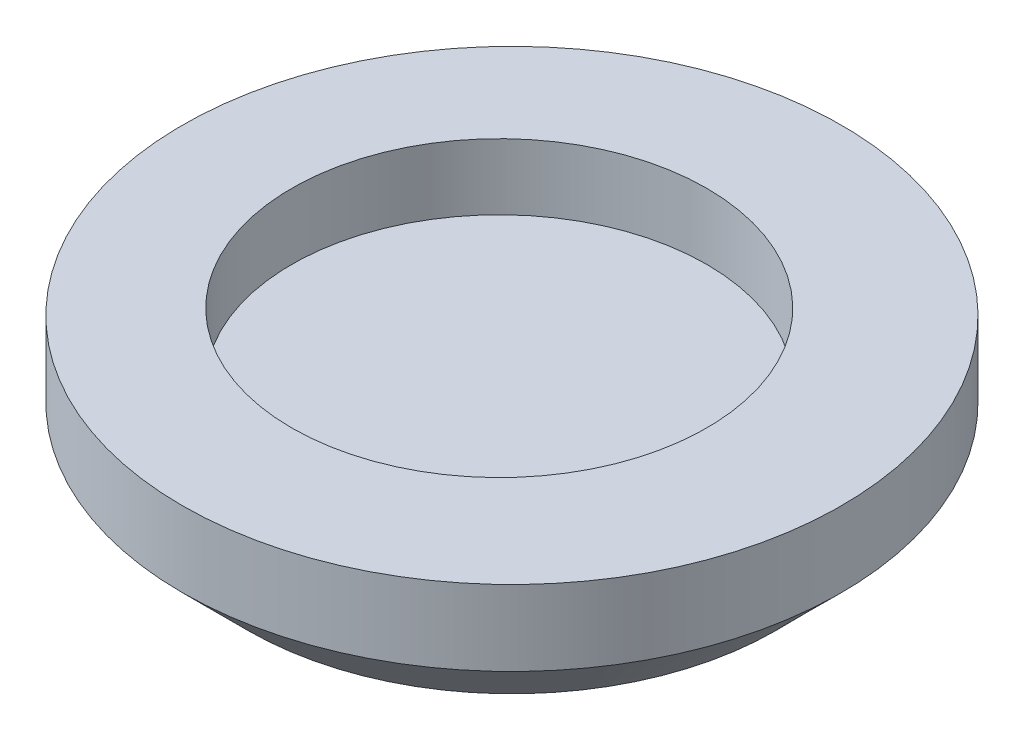
from build123d import *

# Parameters (mm, degrees)
SKETCH1_R           = 35
BOSS_EXTRUDE1_DEPTH = 15
CHAMFER2_SIZE       = 7
SKETCH2_R           = 22.041880944
CUT_EXTRUDE1_DEPTH  = 7


with BuildPart() as part:
    # Sketch1 → Boss-Extrude1 (new body)
    with BuildSketch(Plane(origin=(0, 0, 0), x_dir=(1, 0, 0), z_dir=(0, 1, 0))):
        with Locations(Location((1.345738872, 0, 0), (0, 0, 270))):
            Circle(SKETCH1_R)
    extrude(amount=BOSS_EXTRUDE1_DEPTH)

    # Chamfer2
    chamfer2_edges = [part.edges().sort_by_distance(p)[0] for p in [
        (1.345738872, 0, -35),
    ]]
    chamfer(chamfer2_edges, length=CHAMFER2_SIZE)

    # Sketch2 → Cut-Extrude1 (cut)
    with BuildSketch(Plane(origin=(0, 15, 0), x_dir=(1, 0, 0), z_dir=(0, 1, 0))):
        with Locations(Location((0, 0, 0), (0, 0, 270))):
            Circle(SKETCH2_R)
    extrude(amount=-CUT_EXTRUDE1_DEPTH, mode=Mode.SUBTRACT)


solid = part.part
